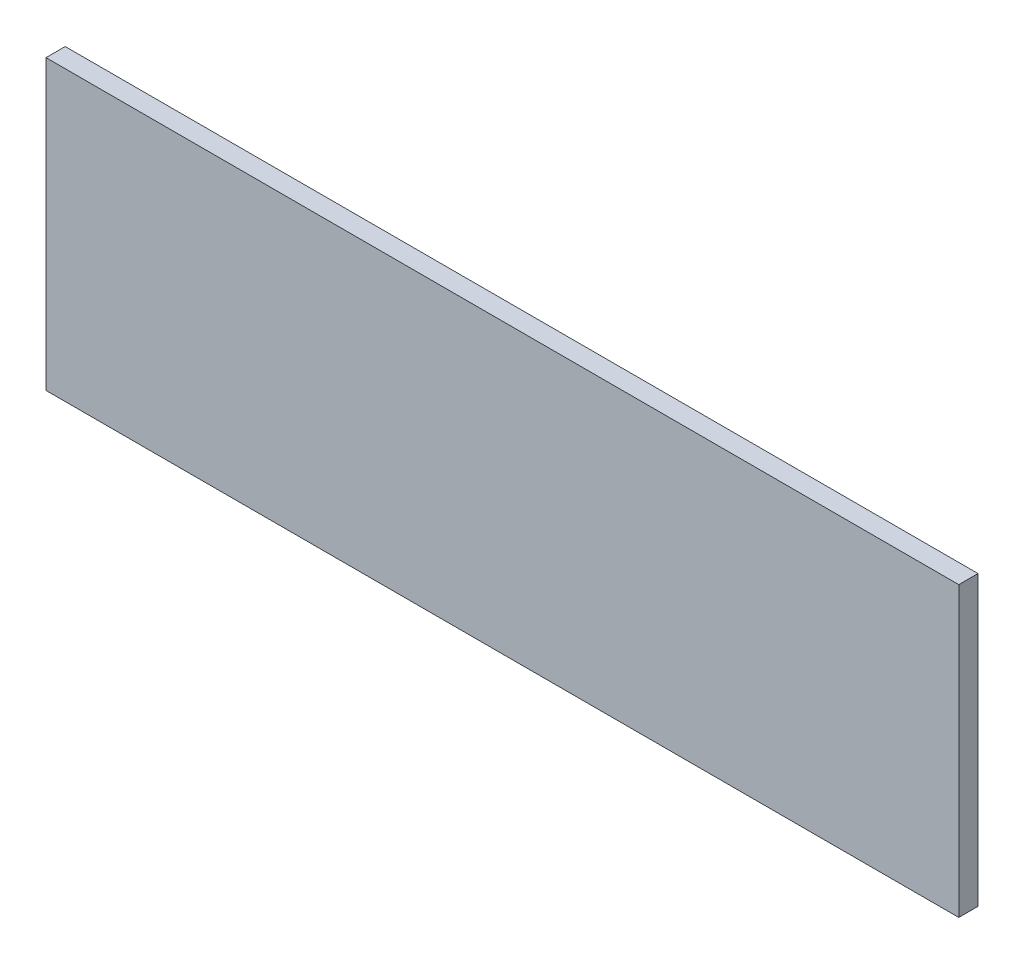
from build123d import *

# Parameters (mm, degrees)
CROQUIS1_W              = 190
CROQUIS1_H              = 60
SALIENTE_EXTRUIR1_DEPTH = 2


with BuildPart() as part:
    # Croquis1 → Saliente-Extruir1 (new, symmetric)
    with BuildSketch(Plane.XY):
        with Locations((95, 30)):
            Rectangle(CROQUIS1_W, CROQUIS1_H)
    extrude(amount=SALIENTE_EXTRUIR1_DEPTH, both=True)


solid = part.part
